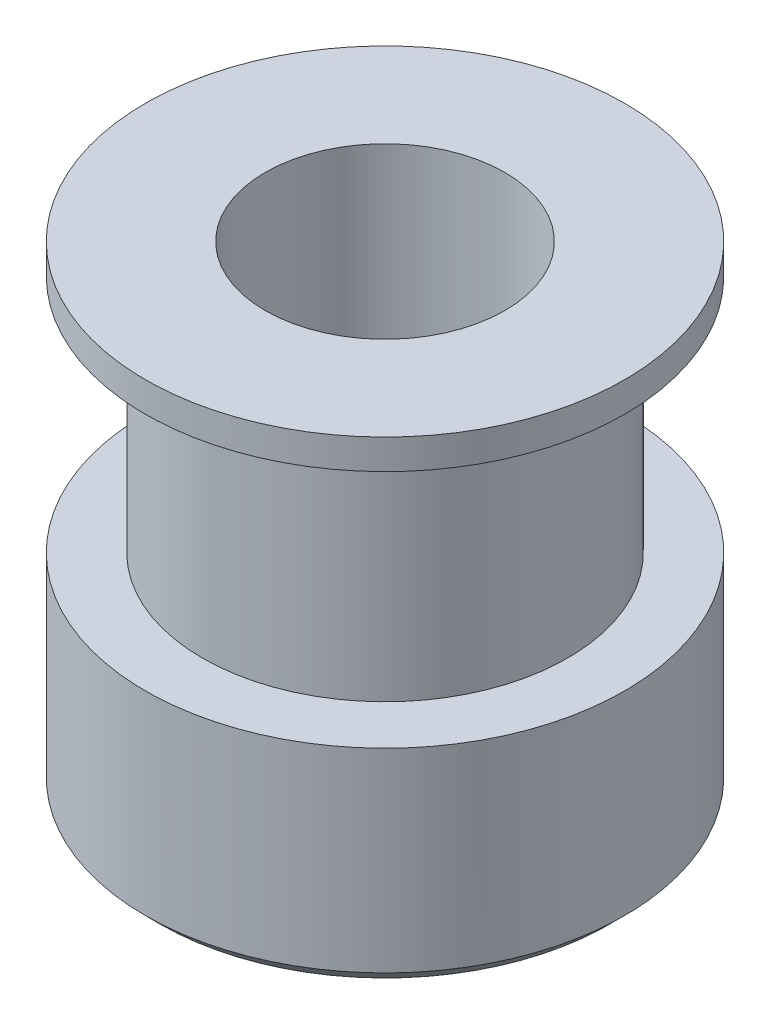
from build123d import *

# Parameters (mm, degrees)
CHAMFER1_SIZE           = 0.5
CUT_EXTRUDE1_REACH      = 21.596
CUT_EXTRUDE1_END_RADIUS = 8
SKETCH2_R               = 1.5
CUT_EXTRUDE2_REACH      = 21.596
CUT_EXTRUDE2_END_RADIUS = 8
SKETCH3_R               = 1.5


with BuildPart() as part:
    # Sketch1 → Revolve1 (revolve)
    with BuildSketch(Plane.XY, mode=Mode.PRIVATE) as revolve1_sk:
        Polygon((-4, 0), (-4, 16), (-8, 16), (-8, 15), (-6.1, 15), (-6.1, 7), (-8, 7), (-8, 0), align=None)
    revolve(revolve1_sk.sketch.rotate(Axis((0, 0, 0), (0, 1, 0)), 270), axis=Axis((0, 0, 0), (0, 1, 0)))

    # Chamfer1
    chamfer1_edges = [part.edges().sort_by_distance(p)[0] for p in [
        (0, 0, 8),
    ]]
    chamfer(chamfer1_edges, length=CHAMFER1_SIZE)

    # Cut-Extrude1: up to this cylinder (the profile starts inside it)
    cut_extrude1_end = Plane(origin=(0, 3.5, 0), z_dir=(0, -1, 0)) * Cylinder(CUT_EXTRUDE1_END_RADIUS, 60.192, mode=Mode.PRIVATE)
    # Sketch2 → Cut-Extrude1 (cut, up to the surface)
    with BuildSketch(Plane.XY, mode=Mode.PRIVATE) as cut_extrude1_sk1:
        with Locations((0, 3.5)):
            Circle(SKETCH2_R)
    cut_extrude1_tool1 = extrude(cut_extrude1_sk1.sketch, amount=-CUT_EXTRUDE1_REACH, mode=Mode.PRIVATE) & cut_extrude1_end
    add(cut_extrude1_tool1.solids().sort_by_distance((0, 3.5, 0))[0], mode=Mode.SUBTRACT)

    # Cut-Extrude2: up to this cylinder (the profile starts inside it)
    cut_extrude2_end = Plane(origin=(0, 3.5, 0), z_dir=(0, -1, 0)) * Cylinder(CUT_EXTRUDE2_END_RADIUS, 60.192, mode=Mode.PRIVATE)
    # Sketch3 → Cut-Extrude2 (cut, up to the surface)
    with BuildSketch(Plane(origin=(0, 0, 0), x_dir=(0, 0, -1), z_dir=(1, 0, 0)), mode=Mode.PRIVATE) as cut_extrude2_sk1:
        with Locations((0, 3.5)):
            Circle(SKETCH3_R)
    cut_extrude2_tool1 = extrude(cut_extrude2_sk1.sketch, amount=-CUT_EXTRUDE2_REACH, mode=Mode.PRIVATE) & cut_extrude2_end
    add(cut_extrude2_tool1.solids().sort_by_distance((0, 3.5, 0))[0], mode=Mode.SUBTRACT)


solid = part.part
